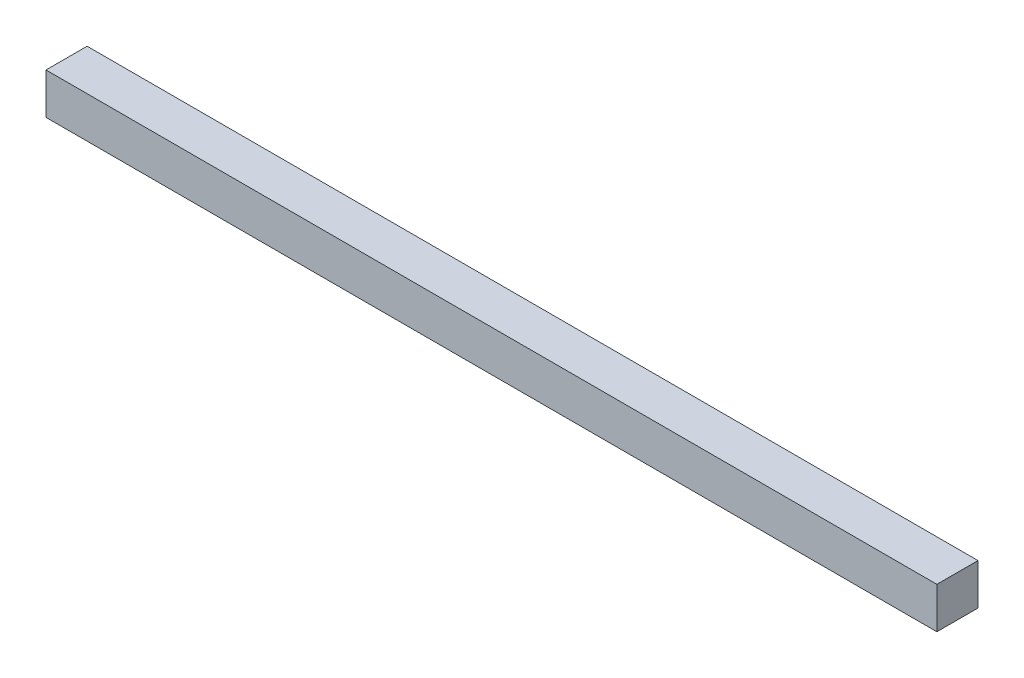
from build123d import *

# Parameters (mm, degrees)
SKETCH_2_W      = 260
SKETCH_2_H      = 12
EXTRUDE_1_DEPTH = 12


with BuildPart() as part:
    # ｽｹｯﾁ2 → ﾎﾞｽ - 押し出し1 (new body)
    with BuildSketch(Plane.XY):
        with Locations((130, 6)):
            Rectangle(SKETCH_2_W, SKETCH_2_H)
    extrude(amount=EXTRUDE_1_DEPTH)


solid = part.part
